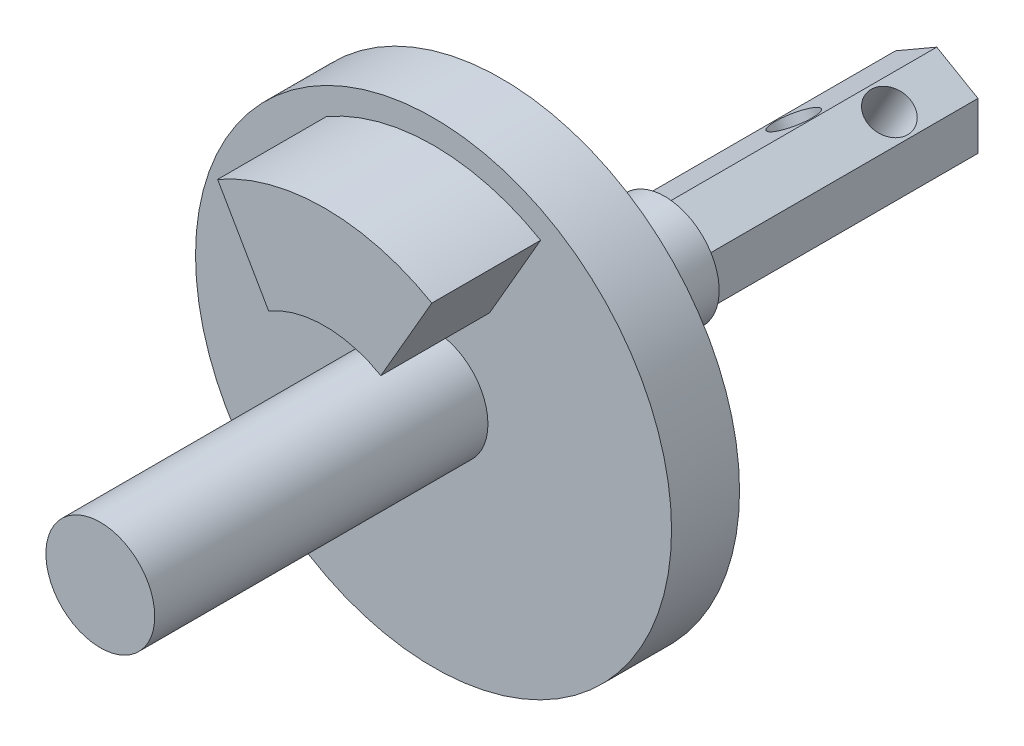
from build123d import *

# Parameters (mm, degrees)
SKETCH1_R           = 17.5
BOSS_EXTRUDE1_DEPTH = 2.5
BOSS_EXTRUDE2_DEPTH = 8
SKETCH3_R           = 4
BOSS_EXTRUDE3_DEPTH = 24.5
BOSS_EXTRUDE4_START = 12
SKETCH7_R           = 4
BOSS_EXTRUDE4_DEPTH = 12
BOSS_EXTRUDE5_DEPTH = 20
SKETCH10_R          = 1.55
CUT_EXTRUDE1_DEPTH  = 6.1
SKETCH11_R          = 1.55
CUT_EXTRUDE4_DEPTH  = 6.1


with BuildPart() as part:
    # Sketch1 → Boss-Extrude1 (new, symmetric)
    with BuildSketch(Plane.XY):
        Circle(SKETCH1_R)
    extrude(amount=BOSS_EXTRUDE1_DEPTH, both=True)

    # Sketch2 → Boss-Extrude2 (add)
    with BuildSketch(Plane.XY.offset(2.5)):
        with BuildLine():
            Line((7.875, 13.63990011), (4.125, 7.144709581))
            ThreePointArc((4.125, 7.144709581), (0, 8.25), (-4.125, 7.144709581))
            Line((-4.125, 7.144709581), (-7.875, 13.63990011))
            ThreePointArc((-7.875, 13.63990011), (0, 15.75), (7.875, 13.63990011))
        make_face()
    extrude(amount=BOSS_EXTRUDE2_DEPTH)

    # Sketch3 → Boss-Extrude3 (add)
    with BuildSketch(Plane.XY.offset(2.5)):
        Circle(SKETCH3_R)
    extrude(amount=BOSS_EXTRUDE3_DEPTH)

    # Sketch7 → Boss-Extrude4 (add)
    with BuildSketch(Plane(origin=(0, 0, -2.5), x_dir=(-1, 0, 0), z_dir=(0, 0, -1)).offset(BOSS_EXTRUDE4_START)):
        with Locations(Location((0, 0, 0), (0, 0, 180))):
            Circle(SKETCH7_R)
    extrude(amount=-BOSS_EXTRUDE4_DEPTH)

    # Sketch9 → Boss-Extrude5 (add)
    with BuildSketch(Plane(origin=(0, 0, -14.5), x_dir=(-1, 0, 0), z_dir=(0, 0, -1))):
        Polygon((0, 3.5), (-3.031088913, 1.75), (-3.031088913, -1.75), (0, -3.5), (3.031088913, -1.75), (3.031088913, 1.75), align=None)
    extrude(amount=BOSS_EXTRUDE5_DEPTH)

    # Sketch10 → Cut-Extrude1 (cut)
    with BuildSketch(Plane(origin=(-1.515544457, -2.625, 0), x_dir=(0.866025403784435, -0.5000000000000062, 0), z_dir=(-0.5000000000000062, -0.866025403784435, 0))):
        with Locations((0, -29.5)):
            Circle(SKETCH10_R)
    extrude(amount=-CUT_EXTRUDE1_DEPTH, mode=Mode.SUBTRACT)

    # Sketch11 → Cut-Extrude4 (cut)
    with BuildSketch(Plane(origin=(1.515544457, -2.625, 0), x_dir=(0, 0, 1), z_dir=(-0.49999999999999717, 0.8660254037844404, 0))):
        with Locations(Location((-25.5, 0, 0), (0, 0, 90))):
            Circle(SKETCH11_R)
    extrude(amount=CUT_EXTRUDE4_DEPTH, mode=Mode.SUBTRACT)


solid = part.part
